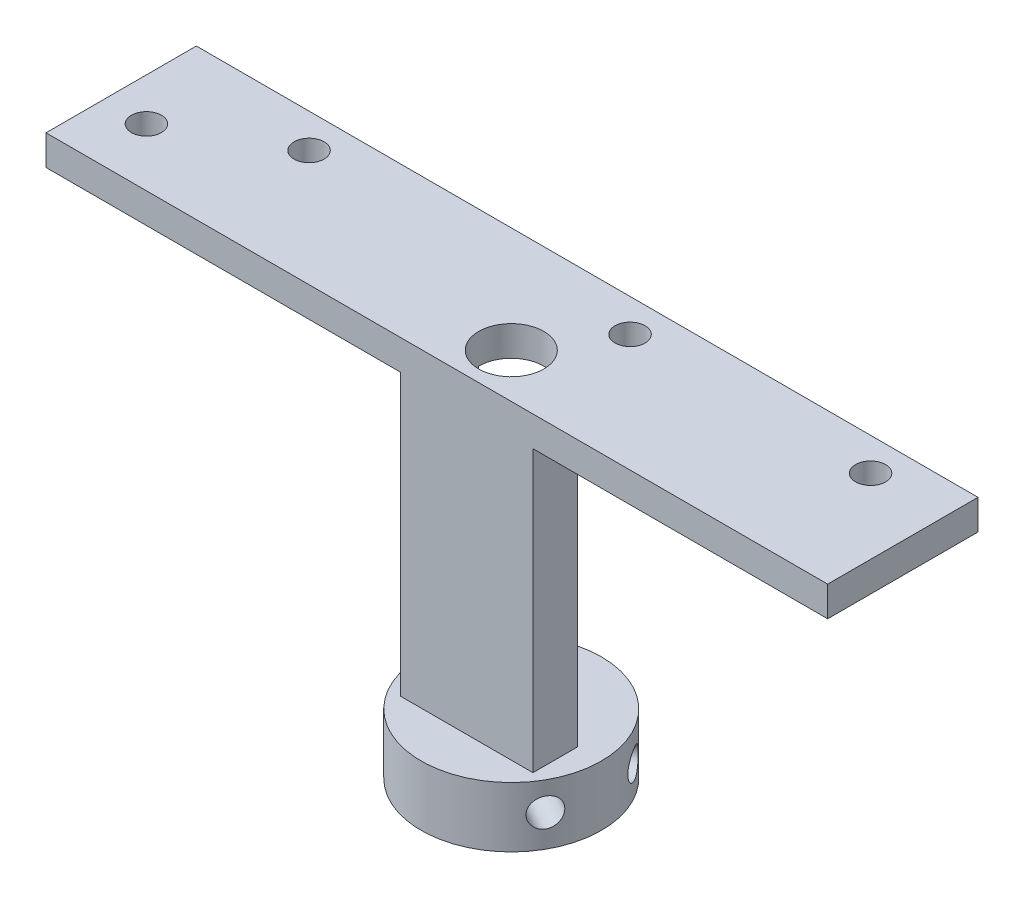
from build123d import *

# Parameters (mm, degrees)
SKETCH_1_W                = 78
SKETCH_1_H                = 15
EXTRUDE_1_DEPTH           = 3
SKETCH_3_R                = 1.5
CUT_EXTRUDE_1_DEPTH       = 3
SKETCH_4_R                = 6
EXTRUDE_2_DEPTH           = 18
SKETCH_5_R                = 4.5
CUT_EXTRUDE_2_DEPTH       = 21
F_2_0MM_2_D               = 3
F_2_0MM_2_DEPTH           = 4.5
F_2_0MM_2_TIP             = 1.5
F_2_0MM_2_ON_FACE_2_D     = 3
F_2_0MM_2_ON_FACE_2_DEPTH = 4.5
F_2_0MM_2_ON_FACE_2_TIP   = 1.5
SKETCH_10_W               = 6
SKETCH_10_H               = 10
CUT_EXTRUDE_3_DEPTH       = 7
SKETCH_13_W               = 19.835687411
SKETCH_13_H               = 21.610205193
CUT_EXTRUDE_4_DEPTH       = 20
SKETCH_14_W               = 11.523038103
SKETCH_14_H               = 10.49031299
EXTRUDE_3_DEPTH           = 3
SKETCH_18_W               = 78
SKETCH_18_H               = 8
EXTRUDE_4_DEPTH           = 3
SKETCH_19_W               = 36.767904102
SKETCH_19_H               = 2.5
EXTRUDE_5_DEPTH           = 12.5
SKETCH_23_R               = 1.65
CUT_EXTRUDE_6_DEPTH       = 12.5
SKETCH_25_W               = 4.236607592
SKETCH_25_H               = 5.36409187
EXTRUDE_7_DEPTH           = 2.5
SKETCH_26_R               = 1.6
CUT_EXTRUDE_7_DEPTH       = 2.5
SKETCH_27_W               = 21.346012392
SKETCH_27_H               = 6.594354882
EXTRUDE_8_DEPTH           = 2.5
SKETCH_28_W               = 36.767231154
SKETCH_28_H               = 5.91819544
EXTRUDE_9_DEPTH           = 2.5
SKETCH_29_W               = 27.660340415
SKETCH_29_H               = 3.5
CUT_EXTRUDE_9_DEPTH       = 2.5
SKETCH_30_W               = 78
SKETCH_30_H               = 8
CUT_EXTRUDE_10_DEPTH      = 100
SKETCH_31_W               = 60.820132647
SKETCH_31_H               = 3
EXTRUDE_10_DEPTH          = 49
SKETCH_32_W               = 48
SKETCH_32_H               = 3.2
CUT_EXTRUDE_11_DEPTH      = 49
SKETCH_33_W               = 15
SKETCH_33_H               = 49.05968874
CUT_EXTRUDE_12_DEPTH      = 100
SKETCH_34_R               = 4.25
EXTRUDE_11_DEPTH          = 49
SKETCH_35_R               = 6
EXTRUDE_12_DEPTH          = 6
SKETCH_36_W               = 8.5
SKETCH_36_H               = 40
CUT_EXTRUDE_13_DEPTH      = 11
SKETCH_37_R               = 3.25
CUT_EXTRUDE_16_DEPTH      = 100
SKETCH_39_W               = 8.456699936
SKETCH_39_H               = 16
CUT_EXTRUDE_17_DEPTH      = 1.25
F_3_0MM_1_D               = 2.85
F_3_0MM_1_DEPTH           = 4.143773618
F_3_0MM_1_TIP             = 0.856226382
F_3_0MM_2_D               = 2.85
F_3_0MM_2_DEPTH           = 4.143773618
F_3_0MM_2_TIP             = 0.856226382
F_3_0MM_3_D               = 2.85
F_3_0MM_3_DEPTH           = 4.143773618
F_3_0MM_3_TIP             = 0.856226382
SKETCH_46_W               = 13.227107738
SKETCH_46_H               = 4.428434999
EXTRUDE_13_DEPTH          = 46
CUT_EXTRUDE_18_DEPTH      = 55
EXTRUDE_START             = 15
EXTRUDE_14_DEPTH          = 15
SKETCH_50_R               = 1.5
CUT_EXTRUDE_19_DEPTH      = 15
SKETCH_51_R               = 1.5
CUT_EXTRUDE_20_DEPTH      = 15
SKETCH_52_R               = 1.5
CUT_EXTRUDE_21_DEPTH      = 15
SKETCH_53_R               = 1.5
CUT_EXTRUDE_22_DEPTH      = 15
SKETCH_54_W               = 78
SKETCH_54_H               = 15
CUT_EXTRUDE_23_DEPTH      = 15
F_3_0MM_4_D               = 2.85
F_3_0MM_4_DEPTH           = 4.143773618
F_3_0MM_4_TIP             = 0.856226382
F_3_0MM_5_D               = 2.85
F_3_0MM_5_DEPTH           = 4.143773618
F_3_0MM_5_TIP             = 0.856226382
SKETCH_60_R               = 9
EXTRUDE_15_DEPTH          = 6
CUT_EXTRUDE_START         = -6
SKETCH_61_R               = 3.25
CUT_EXTRUDE_24_DEPTH      = 6
F_3_0MM_6_D               = 2.85
F_3_0MM_6_DEPTH           = 9.143773618
F_3_0MM_6_TIP             = 0.856226382
F_3_0MM_7_D               = 2.85
F_3_0MM_7_DEPTH           = 9.143773618
F_3_0MM_7_TIP             = 0.856226382
F_3_0MM_7_ON_FACE_2_D     = 2.85
F_3_0MM_7_ON_FACE_2_DEPTH = 9.143773618
F_3_0MM_7_ON_FACE_2_TIP   = 0.856226382
F_3_0MM_8_D               = 2.85
F_3_0MM_8_DEPTH           = 9.143773618
F_3_0MM_8_TIP             = 0.856226382
F_3_0MM_8_ON_FACE_2_D     = 2.85
F_3_0MM_8_ON_FACE_2_DEPTH = 9.143773618
F_3_0MM_8_ON_FACE_2_TIP   = 0.856226382


with BuildPart() as part:
    # 草图1 → 凸台-拉伸1 (new body)
    with BuildSketch(Plane(origin=(0, 0, 0), x_dir=(1, 0, 0), z_dir=(0, 1, 0))):
        Rectangle(SKETCH_1_W, SKETCH_1_H)
    extrude(amount=EXTRUDE_1_DEPTH)

    # 草图3 → 切除-拉伸1 (cut)
    with BuildSketch(Plane(origin=(0, 3, 0), x_dir=(1, 0, 0), z_dir=(0, 1, 0))):
        with Locations(Location((-34.76, -1.72, 0), (0, 0, 270))):
            Circle(SKETCH_3_R)
        with Locations(Location((-24.35, 4.1, 0), (0, 0, 270))):
            Circle(SKETCH_3_R)
        with Locations(Location((31.56, 4.221692081, 0), (0, 0, 270))):
            Circle(SKETCH_3_R)
        with Locations(Location((7.56, 4.221692081, 0), (0, 0, 270))):
            Circle(SKETCH_3_R)
    extrude(amount=-CUT_EXTRUDE_1_DEPTH, mode=Mode.SUBTRACT)

    # 草图4 → 凸台-拉伸2 (add)
    with BuildSketch(Plane(origin=(0, 3, 0), x_dir=(1, 0, 0), z_dir=(0, 1, 0))):
        with Locations(Location((-3, -1.234165229, 0), (0, 0, 270))):
            Circle(SKETCH_4_R)
    extrude(amount=EXTRUDE_2_DEPTH)

    # 草图5 → 切除-拉伸2 (cut)
    with BuildSketch(Plane(origin=(0, 21, 0), x_dir=(1, 0, 0), z_dir=(0, 1, 0))):
        with Locations(Location((-3, -1.234165229, 0), (0, 0, 270))):
            Circle(SKETCH_5_R)
    extrude(amount=-CUT_EXTRUDE_2_DEPTH, mode=Mode.SUBTRACT)

    # Ø2.0mm 暗销孔2
    with Locations(Plane(origin=(-7.901331048, 17.342107422, 4.694938836), x_dir=(-0.576795601176, 0, -0.816888507977), z_dir=(-0.816888507977, 0, 0.576795601176))):
        with Locations((0, 0)):
            Hole(F_2_0MM_2_D / 2, depth=F_2_0MM_2_DEPTH)
            with Locations((0, 0, -(F_2_0MM_2_DEPTH + F_2_0MM_2_TIP / 2))):  # 90° drill point
                Cone(0, F_2_0MM_2_D / 2, F_2_0MM_2_TIP, mode=Mode.SUBTRACT)

    # Ø2.0mm 暗销孔2 on face 2
    with Locations(Plane(origin=(1.071764877, 17.164817099, 5.641061052), x_dir=(0.734483043181, 0, -0.678627039897), z_dir=(0.678627039897, 0, 0.734483043181))):
        with Locations((0, 0)):
            Hole(F_2_0MM_2_ON_FACE_2_D / 2, depth=F_2_0MM_2_ON_FACE_2_DEPTH)
            with Locations((0, 0, -(F_2_0MM_2_ON_FACE_2_DEPTH + F_2_0MM_2_ON_FACE_2_TIP / 2))):  # 90° drill point
                Cone(0, F_2_0MM_2_ON_FACE_2_D / 2, F_2_0MM_2_ON_FACE_2_TIP, mode=Mode.SUBTRACT)

    # 草图10 → 切除-拉伸3 (cut)
    with BuildSketch(Plane(origin=(0, 0, -7.5), x_dir=(-1, 0, 0), z_dir=(0, 0, -1))):
        with Locations((3, 8)):
            Rectangle(SKETCH_10_W, SKETCH_10_H)
    extrude(amount=-CUT_EXTRUDE_3_DEPTH, mode=Mode.SUBTRACT)

    # 草图13 → 切除-拉伸4 (cut)
    with BuildSketch(Plane(origin=(0, 0, -7.5), x_dir=(-1, 0, 0), z_dir=(0, 0, -1))):
        with Locations((3.314421038, 13.805102597)):
            Rectangle(SKETCH_13_W, SKETCH_13_H)
    extrude(amount=-CUT_EXTRUDE_4_DEPTH, mode=Mode.SUBTRACT)

    # 草图14 → 凸台-拉伸3 (add)
    with BuildSketch(Plane(origin=(0, 3, 0), x_dir=(1, 0, 0), z_dir=(0, 1, 0))):
        with Locations((-2.989467433, -1.263493391)):
            Rectangle(SKETCH_14_W, SKETCH_14_H)
    extrude(amount=-EXTRUDE_3_DEPTH)

    # 草图18 → 凸台-拉伸4 (add)
    with BuildSketch(Plane.XZ):
        with Locations((0, 11.5)):
            Rectangle(SKETCH_18_W, SKETCH_18_H)
    extrude(amount=-EXTRUDE_4_DEPTH)

    # 草图19 → 凸台-拉伸5 (add)
    with BuildSketch(Plane.XZ):
        with Locations((0.839237194, 14.25)):
            Rectangle(SKETCH_19_W, SKETCH_19_H)
    extrude(amount=EXTRUDE_5_DEPTH)

    # 草图23 → 切除-拉伸6 (cut)
    with BuildSketch(Plane(origin=(0, 0, 13), x_dir=(-1, 0, 0), z_dir=(0, 0, -1))):
        with Locations((-8.603189245, -6.05592298)):
            Circle(SKETCH_23_R)
        with Locations((2.596810755, -6.05592298)):
            Circle(SKETCH_23_R)
    extrude(amount=-CUT_EXTRUDE_6_DEPTH, mode=Mode.SUBTRACT)

    # 草图25 → 凸台-拉伸7 (add)
    with BuildSketch(Plane(origin=(0, 0, 13), x_dir=(-1, 0, 0), z_dir=(0, 0, -1))):
        with Locations((2.330668631, -6.426480946)):
            Rectangle(SKETCH_25_W, SKETCH_25_H)
    extrude(amount=-EXTRUDE_7_DEPTH)

    # 草图26 → 切除-拉伸7 (cut)
    with BuildSketch(Plane(origin=(0, 0, 13), x_dir=(-1, 0, 0), z_dir=(0, 0, -1))):
        with Locations((4.196810755, -6.05592298)):
            Circle(SKETCH_26_R)
    extrude(amount=-CUT_EXTRUDE_7_DEPTH, mode=Mode.SUBTRACT)

    # 草图27 → 凸台-拉伸8 (add)
    with BuildSketch(Plane(origin=(0, 0, 13), x_dir=(-1, 0, 0), z_dir=(0, 0, -1))):
        with Locations((-2.379316694, -6.691741876)):
            Rectangle(SKETCH_27_W, SKETCH_27_H)
    extrude(amount=-EXTRUDE_8_DEPTH)

    # 草图28 → 凸台-拉伸9 (add)
    with BuildSketch(Plane(origin=(0, 0, 13), x_dir=(-1, 0, 0), z_dir=(0, 0, -1))):
        with Locations((-0.839573668, -15.45909772)):
            Rectangle(SKETCH_28_W, SKETCH_28_H)
    extrude(amount=-EXTRUDE_9_DEPTH)

    # 草图29 → 切除-拉伸9 (cut)
    with BuildSketch(Plane(origin=(0, 0, 13), x_dir=(-1, 0, 0), z_dir=(0, 0, -1))):
        with Locations((-0.633763758, -13.394190827)):
            Rectangle(SKETCH_29_W, SKETCH_29_H)
    extrude(amount=-CUT_EXTRUDE_9_DEPTH, mode=Mode.SUBTRACT)

    # 草图30 → 切除-拉伸10 (cut)
    with BuildSketch(Plane(origin=(0, 3, 0), x_dir=(1, 0, 0), z_dir=(0, 1, 0))):
        with Locations((0, -11.5)):
            Rectangle(SKETCH_30_W, SKETCH_30_H)
    extrude(amount=-CUT_EXTRUDE_10_DEPTH, mode=Mode.SUBTRACT)

    # 草图31 → 凸台-拉伸10 (add)
    with BuildSketch(Plane.XZ):
        with Locations((0.65611444, 6)):
            Rectangle(SKETCH_31_W, SKETCH_31_H)
    extrude(amount=EXTRUDE_10_DEPTH)

    # 草图32 → 切除-拉伸11 (cut)
    with BuildSketch(Plane(origin=(0, 0, 4.5), x_dir=(-1, 0, 0), z_dir=(0, 0, -1))):
        with Locations((-0.175604554, -15.854114518)):
            Rectangle(SKETCH_32_W, SKETCH_32_H)
        with Locations((-0.205191163, -23.054114518)):
            Rectangle(SKETCH_32_W, SKETCH_32_H)
        with Locations((-0.173277927, -30.254114518)):
            Rectangle(SKETCH_32_W, SKETCH_32_H)
        with Locations((-0.15338956, -37.454114518)):
            Rectangle(SKETCH_32_W, SKETCH_32_H)
        with Locations((-0.189333293, -44.654114518)):
            Rectangle(SKETCH_32_W, SKETCH_32_H)
        with Locations((-0.276259634, -9.654114518)):
            Rectangle(SKETCH_32_W, SKETCH_32_H)
    extrude(amount=-CUT_EXTRUDE_11_DEPTH, mode=Mode.SUBTRACT)

    # 草图33 → 切除-拉伸12 (cut)
    with BuildSketch(Plane(origin=(31.066180764, 0, 0), x_dir=(0, 0, -1), z_dir=(1, 0, 0))):
        with Locations((0, -24.52984437)):
            Rectangle(SKETCH_33_W, SKETCH_33_H)
    extrude(amount=-CUT_EXTRUDE_12_DEPTH, mode=Mode.SUBTRACT)

    # 草图34 → 凸台-拉伸11 (add)
    with BuildSketch(Plane.XZ):
        with Locations(Location((3, 3.071565001, 0), (0, 0, 90))):
            Circle(SKETCH_34_R)
    extrude(amount=EXTRUDE_11_DEPTH)

    # 草图35 → 凸台-拉伸12 (add)
    with BuildSketch(Plane.XZ.offset(49)):
        with Locations(Location((3, 3.071565001, 0), (0, 0, 270))):
            Circle(SKETCH_35_R)
    extrude(amount=-EXTRUDE_12_DEPTH)

    # 草图36 → 切除-拉伸13 (cut)
    with BuildSketch(Plane(origin=(0, 0, -7.5), x_dir=(-1, 0, 0), z_dir=(0, 0, -1))):
        with Locations((-3, -20)):
            Rectangle(SKETCH_36_W, SKETCH_36_H)
    extrude(amount=-CUT_EXTRUDE_13_DEPTH, mode=Mode.SUBTRACT)

    # 草图37 → 切除-拉伸16 (cut)
    with BuildSketch(Plane.XZ.offset(49)):
        with Locations(Location((3, 3.071565001, 0), (0, 0, 270))):
            Circle(SKETCH_37_R)
    extrude(amount=-CUT_EXTRUDE_16_DEPTH, mode=Mode.SUBTRACT)

    # 草图39 → 切除-拉伸17 (cut)
    with BuildSketch(Plane(origin=(0, 0, 3.5), x_dir=(-1, 0, 0), z_dir=(0, 0, -1))):
        with Locations((-3, -32)):
            Rectangle(SKETCH_39_W, SKETCH_39_H)
    extrude(amount=-CUT_EXTRUDE_17_DEPTH, mode=Mode.SUBTRACT)

    # Ø3.0mm 暗销孔1
    with Locations(Plane(origin=(3.06916604, -45.926554475, -2.928036324), x_dir=(-0.999933554166, 0, -0.011527673319), z_dir=(0.011527673319, 0, -0.999933554166))):
        with Locations((0, 0)):
            Hole(F_3_0MM_1_D / 2, depth=F_3_0MM_1_DEPTH)
            with Locations((0, 0, -(F_3_0MM_1_DEPTH + F_3_0MM_1_TIP / 2))):  # 118° drill point
                Cone(0, F_3_0MM_1_D / 2, F_3_0MM_1_TIP, mode=Mode.SUBTRACT)

    # Ø3.0mm 暗销孔2
    with Locations(Plane(origin=(-2.19436254, -45.980907568, 6.074663036), x_dir=(-0.500516339146, 0, -0.865727089936), z_dir=(-0.865727089936, 0, 0.500516339146))):
        with Locations((0, 0)):
            Hole(F_3_0MM_2_D / 2, depth=F_3_0MM_2_DEPTH)
            with Locations((0, 0, -(F_3_0MM_2_DEPTH + F_3_0MM_2_TIP / 2))):  # 118° drill point
                Cone(0, F_3_0MM_2_D / 2, F_3_0MM_2_TIP, mode=Mode.SUBTRACT)

    # Ø3.0mm 暗销孔3
    with Locations(Plane(origin=(8.205806468, -46.039954185, 6.054781221), x_dir=(-0.497202703373, 0, 0.86763441135), z_dir=(0.86763441135, 0, 0.497202703373))):
        with Locations((0, 0)):
            Hole(F_3_0MM_3_D / 2, depth=F_3_0MM_3_DEPTH)
            with Locations((0, 0, -(F_3_0MM_3_DEPTH + F_3_0MM_3_TIP / 2))):  # 118° drill point
                Cone(0, F_3_0MM_3_D / 2, F_3_0MM_3_TIP, mode=Mode.SUBTRACT)

    # 草图46 → 凸台-拉伸13 (add)
    with BuildSketch(Plane(origin=(0, 3, 0), x_dir=(1, 0, 0), z_dir=(0, 1, 0))):
        with Locations((2.976074231, -5.285782501)):
            Rectangle(SKETCH_46_W, SKETCH_46_H)
    extrude(amount=-EXTRUDE_13_DEPTH)

    # 草图48 → 切除-拉伸18 (cut)
    with BuildSketch(Plane.XZ.offset(49)):
        with BuildLine():
            Line((-0.25, 3.071565001), (6.25, 3.071565001))
            ThreePointArc((6.25, 3.071565001), (3, 6.321565001), (-0.25, 3.071565001))
        make_face()
    extrude(amount=-CUT_EXTRUDE_18_DEPTH, mode=Mode.SUBTRACT)

    # 草图49 → 凸台-拉伸14 (add)
    with BuildSketch(Plane.XZ.offset(EXTRUDE_START)):
        with BuildLine():
            Line((-0.25, 3.071565001), (-3.637479638, 3.071565001))
            Line((-3.637479638, 3.071565001), (-3.637479638, 7.5))
            Line((-3.637479638, 7.5), (-39, 7.5))
            Line((-39, 7.5), (-39, -7.5))
            Line((-39, -7.5), (39, -7.5))
            Line((39, -7.5), (39, 7.5))
            Line((39, 7.5), (9.5896281, 7.5))
            Line((9.5896281, 7.5), (9.5896281, 3.071565001))
            Line((9.5896281, 3.071565001), (6.25, 3.071565001))
            ThreePointArc((6.25, 3.071565001), (3, -0.178434999), (-0.25, 3.071565001))
        make_face()
    extrude(amount=-EXTRUDE_14_DEPTH)

    # 草图50 → 切除-拉伸19 (cut)
    with BuildSketch(Plane(origin=(0, 0, 0), x_dir=(1, 0, 0), z_dir=(0, 1, 0))):
        with Locations(Location((-34.76, -1.72, 0), (0, 0, 270))):
            Circle(SKETCH_50_R)
    extrude(amount=-CUT_EXTRUDE_19_DEPTH, mode=Mode.SUBTRACT)

    # 草图51 → 切除-拉伸20 (cut)
    with BuildSketch(Plane(origin=(0, 0, 0), x_dir=(1, 0, 0), z_dir=(0, 1, 0))):
        with Locations(Location((-24.35, 4.1, 0), (0, 0, 270))):
            Circle(SKETCH_51_R)
    extrude(amount=-CUT_EXTRUDE_20_DEPTH, mode=Mode.SUBTRACT)

    # 草图52 → 切除-拉伸21 (cut)
    with BuildSketch(Plane(origin=(0, 0, 0), x_dir=(1, 0, 0), z_dir=(0, 1, 0))):
        with Locations(Location((7.56, 4.221692081, 0), (0, 0, 270))):
            Circle(SKETCH_52_R)
    extrude(amount=-CUT_EXTRUDE_21_DEPTH, mode=Mode.SUBTRACT)

    # 草图53 → 切除-拉伸22 (cut)
    with BuildSketch(Plane(origin=(0, 0, 0), x_dir=(1, 0, 0), z_dir=(0, 1, 0))):
        with Locations(Location((31.56, 4.221692081, 0), (0, 0, 270))):
            Circle(SKETCH_53_R)
    extrude(amount=-CUT_EXTRUDE_22_DEPTH, mode=Mode.SUBTRACT)

    # 草图54 → 切除-拉伸23 (cut)
    with BuildSketch(Plane(origin=(0, 3, 0), x_dir=(1, 0, 0), z_dir=(0, 1, 0))):
        Rectangle(SKETCH_54_W, SKETCH_54_H)
    extrude(amount=-CUT_EXTRUDE_23_DEPTH, mode=Mode.SUBTRACT)

    # Ø3.0mm 暗销孔4
    with Locations(Plane(origin=(-2.206820669, -45.974417651, 0.09011929), x_dir=(0.496907618427, 0, -0.867803444767), z_dir=(-0.867803444767, 0, -0.496907618427))):
        with Locations((0, 0)):
            Hole(F_3_0MM_4_D / 2, depth=F_3_0MM_4_DEPTH)
            with Locations((0, 0, -(F_3_0MM_4_DEPTH + F_3_0MM_4_TIP / 2))):  # 118° drill point
                Cone(0, F_3_0MM_4_D / 2, F_3_0MM_4_TIP, mode=Mode.SUBTRACT)

    # Ø3.0mm 暗销孔5
    with Locations(Plane(origin=(8.192046128, -46.012961975, 0.064463904), x_dir=(0.501183516141, 0, 0.865341021303), z_dir=(0.865341021303, 0, -0.501183516141))):
        with Locations((0, 0)):
            Hole(F_3_0MM_5_D / 2, depth=F_3_0MM_5_DEPTH)
            with Locations((0, 0, -(F_3_0MM_5_DEPTH + F_3_0MM_5_TIP / 2))):  # 118° drill point
                Cone(0, F_3_0MM_5_D / 2, F_3_0MM_5_TIP, mode=Mode.SUBTRACT)

    # 草图60 → 凸台-拉伸15 (add)
    with BuildSketch(Plane.XZ.offset(49)):
        with Locations(Location((3, 3.071565001, 0), (0, 0, 270))):
            Circle(SKETCH_60_R)
    extrude(amount=-EXTRUDE_15_DEPTH)

    # 草图61 → 切除-拉伸24 (cut)
    with BuildSketch(Plane(origin=(0, -43, 0), x_dir=(1, 0, 0), z_dir=(0, 1, 0)).offset(CUT_EXTRUDE_START)):
        with Locations(Location((3, -3.071565001, 0), (0, 0, 270))):
            Circle(SKETCH_61_R)
    extrude(amount=CUT_EXTRUDE_24_DEPTH, mode=Mode.SUBTRACT)

    # Ø3.0mm 暗销孔6
    with Locations(Plane(origin=(3.050736778, -46.031856967, -5.928291986), x_dir=(-0.999984109623, 0, -0.00563741982), z_dir=(0.00563741982, 0, -0.999984109623))):
        with Locations((0, 0)):
            Hole(F_3_0MM_6_D / 2, depth=F_3_0MM_6_DEPTH)
            with Locations((0, 0, -(F_3_0MM_6_DEPTH + F_3_0MM_6_TIP / 2))):  # 118° drill point
                Cone(0, F_3_0MM_6_D / 2, F_3_0MM_6_TIP, mode=Mode.SUBTRACT)

    # Ø3.0mm 暗销孔7
    with Locations(Plane(origin=(10.848450321, -45.825193133, 7.476315567), x_dir=(-0.489416729598, 0, 0.872050035715), z_dir=(0.872050035715, 0, 0.489416729598))):
        with Locations((0, 0)):
            Hole(F_3_0MM_7_D / 2, depth=F_3_0MM_7_DEPTH)
            with Locations((0, 0, -(F_3_0MM_7_DEPTH + F_3_0MM_7_TIP / 2))):  # 118° drill point
                Cone(0, F_3_0MM_7_D / 2, F_3_0MM_7_TIP, mode=Mode.SUBTRACT)

    # Ø3.0mm 暗销孔7 on face 2
    with Locations(Plane(origin=(-4.772770579, -45.937170264, 7.608528471), x_dir=(-0.504107089648, 0, -0.863641153586), z_dir=(-0.863641153586, 0, 0.504107089648))):
        with Locations((0, 0)):
            Hole(F_3_0MM_7_ON_FACE_2_D / 2, depth=F_3_0MM_7_ON_FACE_2_DEPTH)
            with Locations((0, 0, -(F_3_0MM_7_ON_FACE_2_DEPTH + F_3_0MM_7_ON_FACE_2_TIP / 2))):  # 118° drill point
                Cone(0, F_3_0MM_7_ON_FACE_2_D / 2, F_3_0MM_7_ON_FACE_2_TIP, mode=Mode.SUBTRACT)

    # Ø3.0mm 暗销孔8
    with Locations(Plane(origin=(-4.802469017, -45.919748804, -1.414131961), x_dir=(0.498410773573, 0, -0.866941001906), z_dir=(-0.866941001906, 0, -0.498410773573))):
        with Locations((0, 0)):
            Hole(F_3_0MM_8_D / 2, depth=F_3_0MM_8_DEPTH)
            with Locations((0, 0, -(F_3_0MM_8_DEPTH + F_3_0MM_8_TIP / 2))):  # 118° drill point
                Cone(0, F_3_0MM_8_D / 2, F_3_0MM_8_TIP, mode=Mode.SUBTRACT)

    # Ø3.0mm 暗销孔8 on face 2
    with Locations(Plane(origin=(10.779191078, -46.092465244, -1.454380886), x_dir=(0.502882779306, 0, 0.864354620672), z_dir=(0.864354620672, 0, -0.502882779306))):
        with Locations((1e-09, 0)):
            Hole(F_3_0MM_8_ON_FACE_2_D / 2, depth=F_3_0MM_8_ON_FACE_2_DEPTH)
            with Locations((0, 0, -(F_3_0MM_8_ON_FACE_2_DEPTH + F_3_0MM_8_ON_FACE_2_TIP / 2))):  # 118° drill point
                Cone(0, F_3_0MM_8_ON_FACE_2_D / 2, F_3_0MM_8_ON_FACE_2_TIP, mode=Mode.SUBTRACT)


solid = part.part
